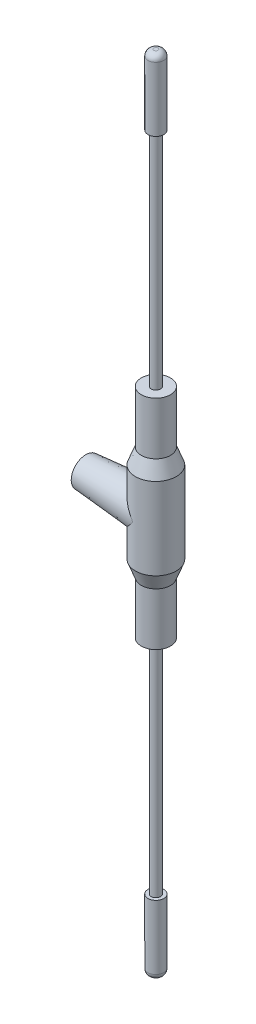
from build123d import *

# Parameters (mm, degrees)
REDONDEO1_R = 1


with BuildPart() as part:
    # Croquis1 → Revolución1 (revolve)
    with BuildSketch(Plane.XY):
        Polygon((0, 7), (0, -7), (0, -10), (0, -68.645053037), (-1.35, -68.645053037), (-1.35, -56.645053037), (-0.8, -56.645053037), (-0.8, -18.645053037), (-2.5, -18.645053037), (-2.5, -9.645053037), (-3.5, -7), (-3.5, 7), (-2.5, 9.645053037), (-2.5, 18.645053037), (-0.8, 18.645053037), (-0.8, 56.645053037), (-1.35, 56.645053037), (-1.35, 68.645053037), (0, 68.645053037), (0, 10), align=None)
    revolve(axis=Axis((0, 68.645053037, 0), (0, -1, 0)))

    # Croquis2 → Revolución2 (revolve)
    with BuildSketch(Plane.XY):
        Polygon((0, 0), (0, 3.5), (-12, 2.5), (-12, 0), align=None)
    revolve(axis=Axis((0, 0, 0), (-1, 0, 0)))

    # Redondeo1
    redondeo1_edges = [part.edges().sort_by_distance(p)[0] for p in [
        (1.35, -68.645053037, 0),
        (1.35, 68.645053037, 0),
    ]]
    fillet(redondeo1_edges, radius=REDONDEO1_R)


solid = part.part
